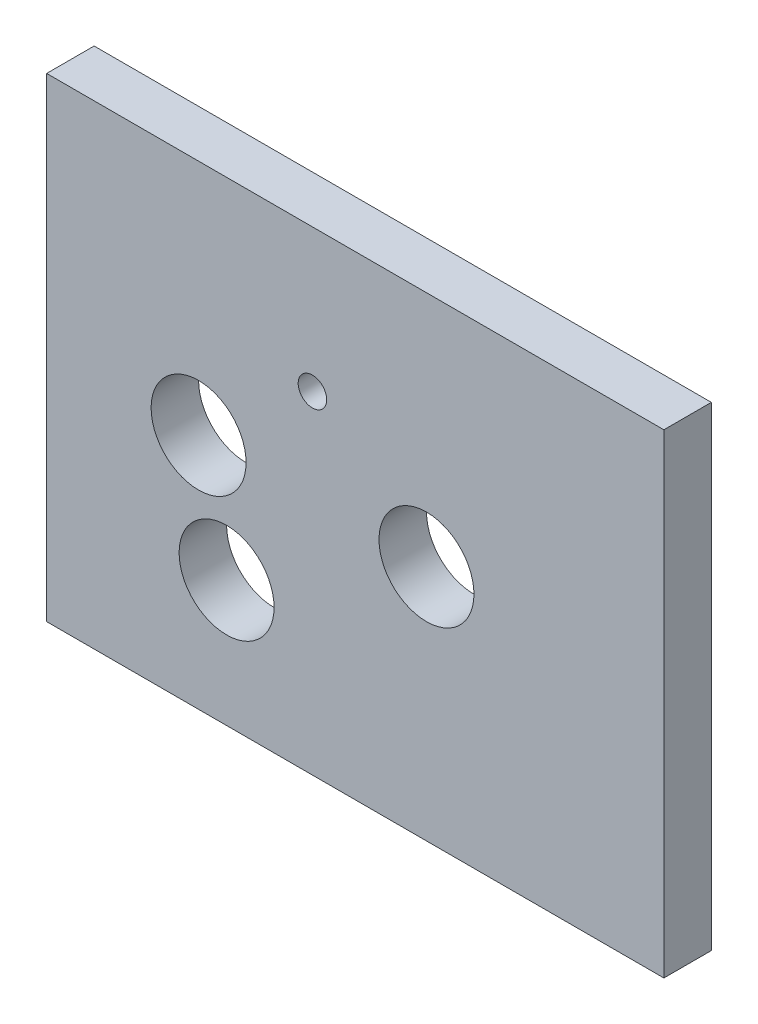
from build123d import *

# Parameters (mm, degrees)
SKETCH3_W           = 65
SKETCH3_H           = 50
BOSS_EXTRUDE2_DEPTH = 5
SKETCH4_R           = 1.5
CUT_EXTRUDE2_DEPTH  = 5
CUT_EXTRUDE3_START  = -10
CUT_EXTRUDE3_DEPTH  = 10


with BuildPart() as part:
    # Sketch3 → Boss-Extrude2 (new body)
    with BuildSketch(Plane.XY):
        with Locations((32.5, -25)):
            Rectangle(SKETCH3_W, SKETCH3_H)
    extrude(amount=BOSS_EXTRUDE2_DEPTH)

    # Sketch4 → Cut-Extrude2 (cut)
    with BuildSketch(Plane.XY.offset(5)):
        with Locations((40, -25)):
            Circle(SKETCH4_R)
        with Locations((16, -25)):
            Circle(SKETCH4_R)
        with Locations((27.986991667, -15.016411928)):
            Circle(SKETCH4_R)
    extrude(amount=-CUT_EXTRUDE2_DEPTH, mode=Mode.SUBTRACT)

    # Sketch5 → Cut-Extrude3 (cut)
    with BuildSketch(Plane(origin=(0, 0, 0), x_dir=(-1, 0, 0), z_dir=(0, 0, -1)).offset(CUT_EXTRUDE3_START)):
        with BuildLine():
            ThreePointArc((-38.689834025, -25.730386964), (-41.451765987, -24.622673194), (-38.5, -25))
            Line((-38.5, -25), (-35, -25))
            ThreePointArc((-35, -25), (-44.839219957, -23.742243979), (-35.632780083, -27.434623214))
            Line((-35.632780083, -27.434623214), (-38.689834025, -25.730386964))
        make_face()
        with BuildLine():
            Line((-35, -25), (-38.5, -25))
            ThreePointArc((-38.5, -25), (-38.548234013, -25.377326806), (-38.689834025, -25.730386964))
            Line((-38.689834025, -25.730386964), (-35.632780083, -27.434623214))
            ThreePointArc((-35.632780083, -27.434623214), (-35.160780043, -26.257756021), (-35, -25))
        make_face()
        with BuildLine():
            ThreePointArc((-17.730991736, -31.885758318), (-20.933750127, -32.145250419), (-23.317219917, -34.300260679))
            Line((-23.317219917, -34.300260679), (-18.95, -36.734883894))
            Line((-18.95, -36.734883894), (-17.730991736, -31.885758318))
        make_face()
        with BuildLine():
            Line((-18.95, -36.734883894), (-23.317219917, -34.300260679))
            ThreePointArc((-23.317219917, -34.300260679), (-20.207756021, -41.574103851), (-13.95, -36.734883894))
            ThreePointArc((-13.95, -36.734883894), (-15.006965552, -33.660395426), (-17.730991736, -31.885758318))
            Line((-17.730991736, -31.885758318), (-18.95, -36.734883894))
        make_face()
        with BuildLine():
            ThreePointArc((-11, -25), (-16, -20), (-21, -25))
            Line((-21, -25), (-17.5, -25))
            ThreePointArc((-17.5, -25), (-16, -23.5), (-14.5, -25))
            ThreePointArc((-14.5, -25), (-15.07765346, -26.182910335), (-16.365702479, -26.454737673))
            Line((-16.365702479, -26.454737673), (-17.219008264, -29.849125576))
            ThreePointArc((-17.219008264, -29.849125576), (-12.925511532, -28.943034448), (-11, -25))
        make_face()
        with BuildLine():
            Line((-17.5, -25), (-21, -25))
            ThreePointArc((-21, -25), (-19.943034448, -28.074488468), (-17.219008264, -29.849125576))
            Line((-17.219008264, -29.849125576), (-16.365702479, -26.454737673))
            ThreePointArc((-16.365702479, -26.454737673), (-17.182910335, -25.92234654), (-17.5, -25))
        make_face()
    extrude(amount=CUT_EXTRUDE3_DEPTH, mode=Mode.SUBTRACT)


solid = part.part
